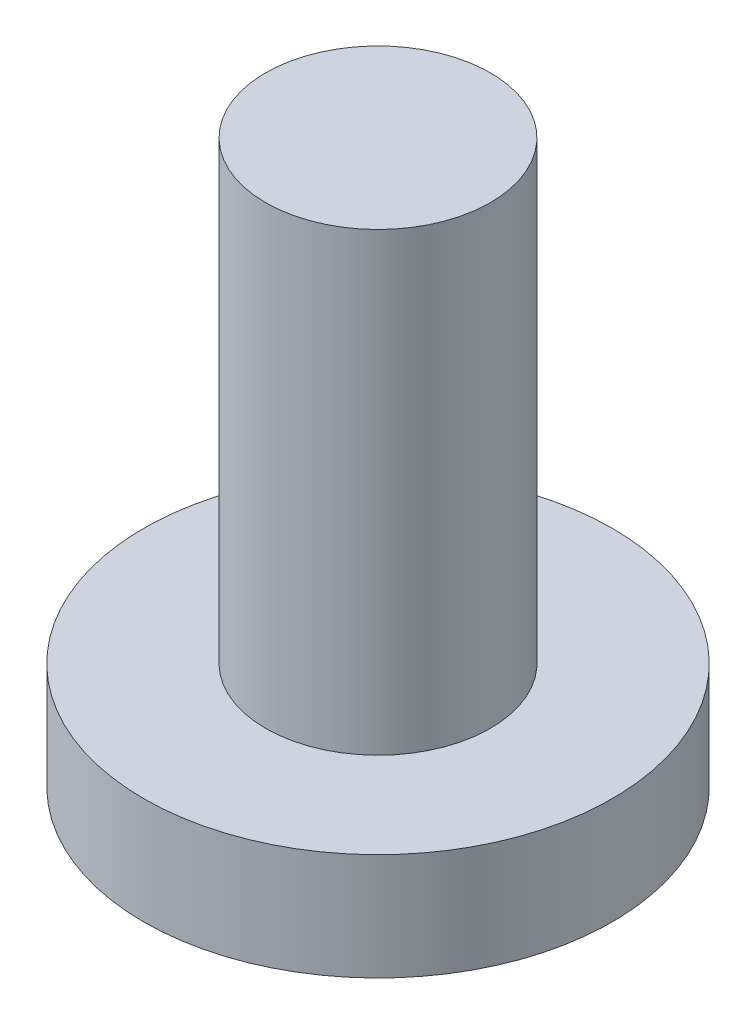
from build123d import *

# Parameters (mm, degrees)
SKETCH1_R           = 7.5
SKETCH1_R_2         = 3.6
BOSS_EXTRUDE1_DEPTH = 3.42
SKETCH1_2_R         = 3.6
BOSS_EXTRUDE2_DEPTH = 18


with BuildPart() as part:
    # Sketch1 → Boss-Extrude1 (new body)
    with BuildSketch(Plane(origin=(0, 0, 0), x_dir=(1, 0, 0), z_dir=(0, 1, 0))):
        Circle(SKETCH1_R)
        Circle(SKETCH1_R_2, mode=Mode.SUBTRACT)
    extrude(amount=BOSS_EXTRUDE1_DEPTH)

    # Sketch1<2> → Boss-Extrude2 (add)
    with BuildSketch(Plane(origin=(0, 0, 0), x_dir=(1, 0, 0), z_dir=(0, 1, 0))):
        Circle(SKETCH1_2_R)
    extrude(amount=BOSS_EXTRUDE2_DEPTH)


solid = part.part
